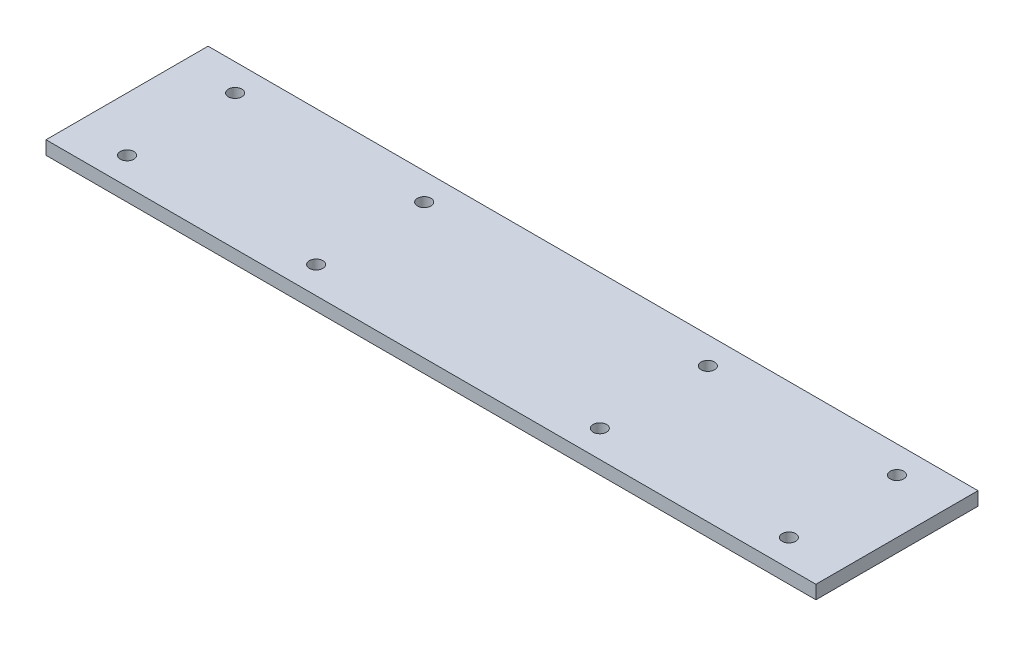
from build123d import *

# Parameters (mm, degrees)
SKETCH1_W           = 723.9
SKETCH1_H           = 152.4
BOSS_EXTRUDE1_DEPTH = 12.7
SKETCH2_R           = 6.35
CUT_EXTRUDE1_DEPTH  = 455.784476325


with BuildPart() as part:
    # Sketch1 → Boss-Extrude1 (new body)
    with BuildSketch(Plane(origin=(0, 0, 0), x_dir=(1, 0, 0), z_dir=(0, 1, 0))):
        with Locations((66.351143947, 76.2)):
            Rectangle(SKETCH1_W, SKETCH1_H)
    extrude(amount=BOSS_EXTRUDE1_DEPTH)

    # Sketch2 → Cut-Extrude1 (cut, through all)
    with BuildSketch(Plane(origin=(0, 12.7, 0), x_dir=(1, 0, 0), z_dir=(0, 1, 0))):
        with Locations(Location((377.501143947, 127, 0), (0, 0, 270))):
            Circle(SKETCH2_R)
        with Locations(Location((377.501143947, 25.4, 0), (0, 0, 270))):
            Circle(SKETCH2_R)
        with Locations(Location((199.701143947, 127, 0), (0, 0, 270))):
            Circle(SKETCH2_R)
        with Locations(Location((199.701143947, 25.4, 0), (0, 0, 270))):
            Circle(SKETCH2_R)
        with Locations(Location((-244.798856053, 127, 0), (0, 0, 90))):
            Circle(SKETCH2_R)
        with Locations(Location((-66.998856053, 127, 0), (0, 0, 90))):
            Circle(SKETCH2_R)
        with Locations(Location((-244.798856053, 25.4, 0), (0, 0, 90))):
            Circle(SKETCH2_R)
        with Locations(Location((-66.998856053, 25.4, 0), (0, 0, 90))):
            Circle(SKETCH2_R)
    extrude(amount=-CUT_EXTRUDE1_DEPTH, mode=Mode.SUBTRACT)


solid = part.part
